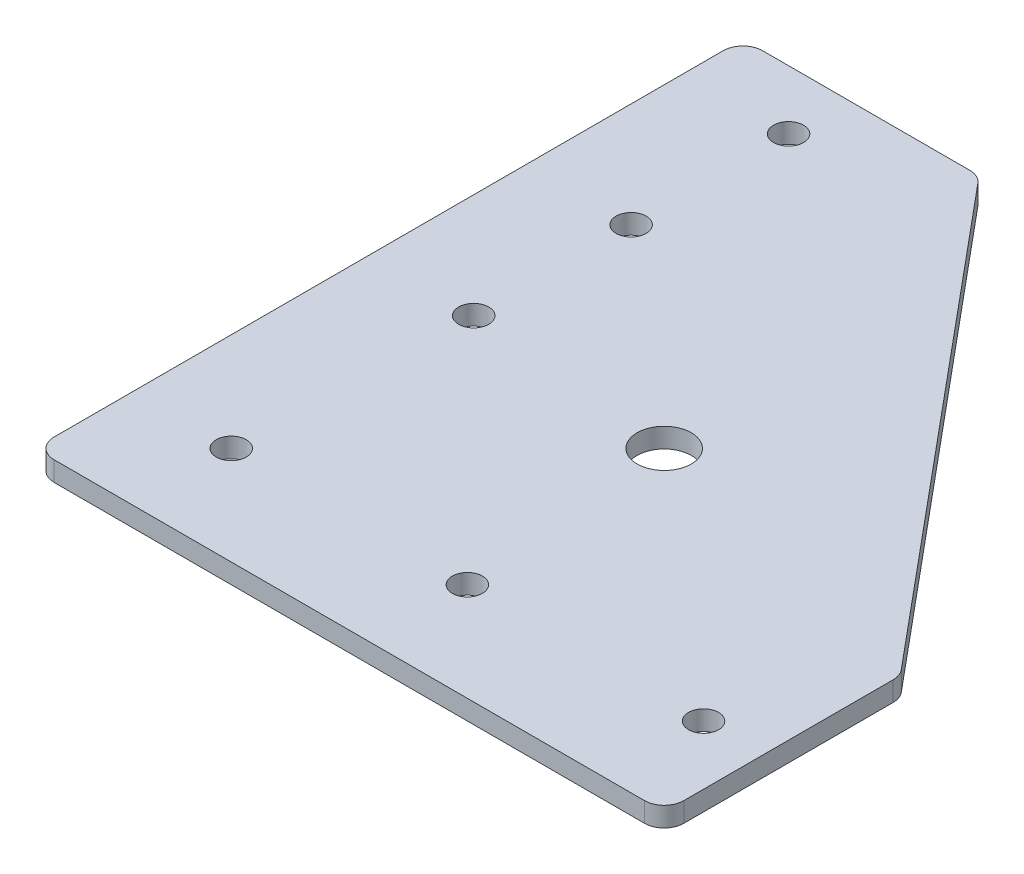
from build123d import *

# Parameters (mm, degrees)
SKETCH1_R           = 2.4257
BOSS_EXTRUDE1_DEPTH = 3.175
FILLET1_R           = 3.175
SKETCH2_R           = 4.3688
CUT_EXTRUDE1_DEPTH  = 153.961206275


with BuildPart() as part:
    # Sketch1 → Boss-Extrude1 (new body)
    with BuildSketch(Plane(origin=(0, 0, 0), x_dir=(1, 0, 0), z_dir=(0, 1, 0))):
        Polygon((0, 0), (0, 114.3), (38.1, 114.3), (101.6, 38.1), (101.6, 0), align=None)
        with Locations(Location((15.875, 15.875, 0), (0, 0, 270))):
            Circle(SKETCH1_R, mode=Mode.SUBTRACT)
        with Locations(Location((53.975, 15.875, 0), (0, 0, 270))):
            Circle(SKETCH1_R, mode=Mode.SUBTRACT)
        with Locations(Location((92.075, 15.875, 0), (0, 0, 270))):
            Circle(SKETCH1_R, mode=Mode.SUBTRACT)
        with Locations(Location((16.891, 53.975, 0), (0, 0, 270))):
            Circle(SKETCH1_R, mode=Mode.SUBTRACT)
        with Locations(Location((16.891, 79.375, 0), (0, 0, 270))):
            Circle(SKETCH1_R, mode=Mode.SUBTRACT)
        with Locations(Location((16.891, 104.775, 0), (0, 0, 270))):
            Circle(SKETCH1_R, mode=Mode.SUBTRACT)
    extrude(amount=BOSS_EXTRUDE1_DEPTH)

    # Fillet1
    fillet1_edges = [part.edges().sort_by_distance(p)[0] for p in [
        (0, 1.5875, 0),
        (0, 1.5875, -114.3),
        (38.1, 1.5875, -114.3),
        (101.6, 1.5875, -38.1),
        (101.6, 1.5875, 0),
    ]]
    fillet(fillet1_edges, radius=FILLET1_R)

    # Sketch2 → Cut-Extrude1 (cut, through all)
    with BuildSketch(Plane.XZ):
        with Locations(Location((50.8, -50.8, 0), (0, 0, 270))):
            Circle(SKETCH2_R)
    extrude(amount=-CUT_EXTRUDE1_DEPTH, mode=Mode.SUBTRACT)


solid = part.part
